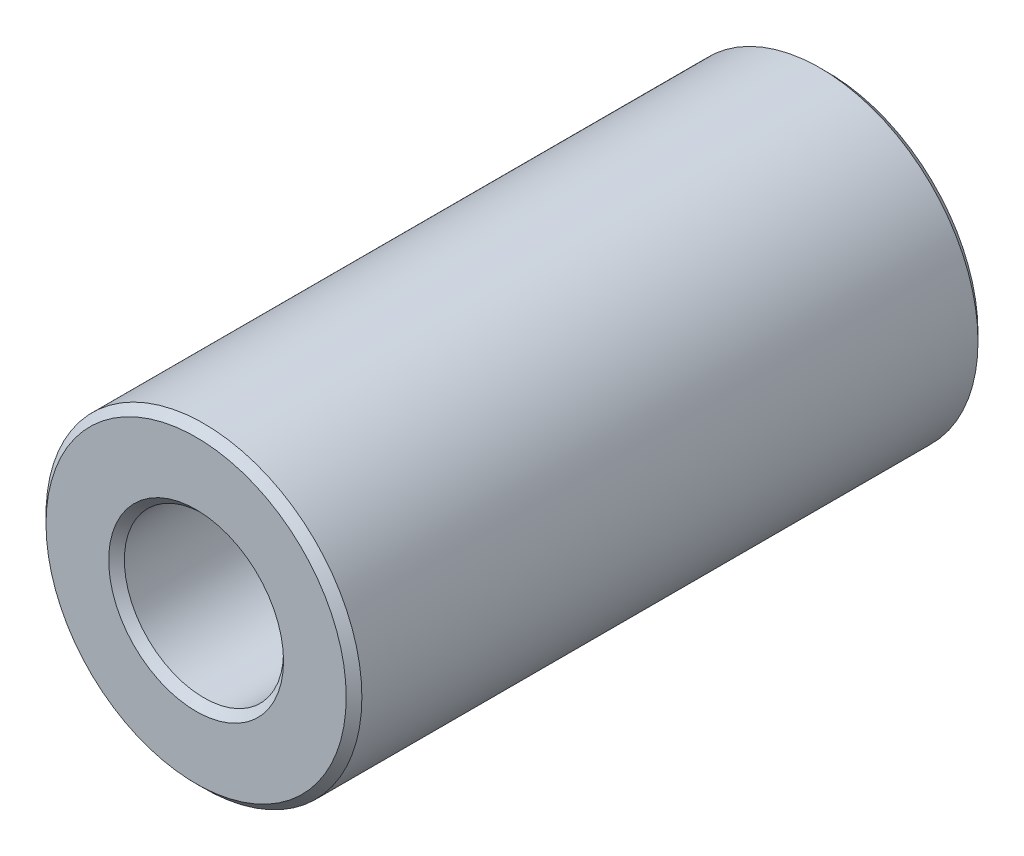
from build123d import *

# Parameters (mm, degrees)
BOSS_EXTRUDE1_DEPTH      = 12.7
BOSS_EXTRUDE1_DEPTH_BACK = 12.7
SKETCH3_R                = 6.35
SKETCH3_R_2              = 3.2004
CHAMFER1_SIZE            = 0.31496


with BuildPart() as part:
    # Sketch3 → Boss-Extrude1 (new, two sides: drawn at the far end of the back side and taken through both)
    with BuildSketch(Plane.XY.offset(-BOSS_EXTRUDE1_DEPTH_BACK)):
        Circle(SKETCH3_R)
        Circle(SKETCH3_R_2, mode=Mode.SUBTRACT)
    extrude(amount=BOSS_EXTRUDE1_DEPTH + BOSS_EXTRUDE1_DEPTH_BACK)

    # Chamfer1
    chamfer1_edges = [part.edges().sort_by_distance(p)[0] for p in [
        (-6.35, 0, -12.7),
        (-3.2004, 0, -12.7),
        (-6.35, 0, 12.7),
        (-3.2004, 0, 12.7),
    ]]
    chamfer(chamfer1_edges, length=CHAMFER1_SIZE)


solid = part.part
